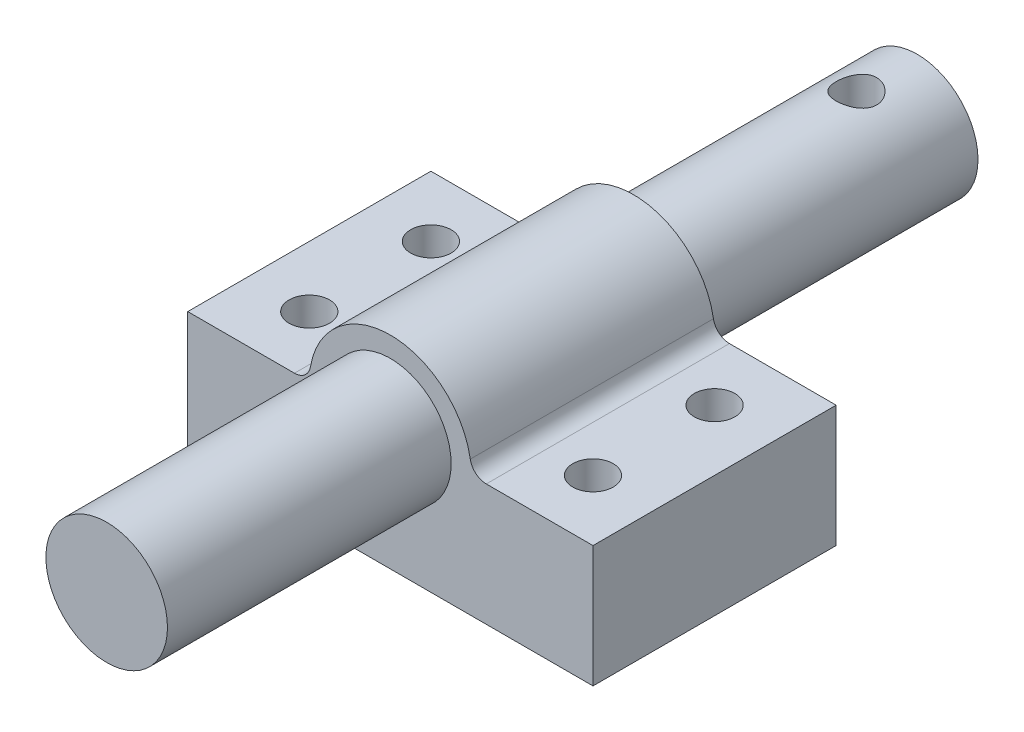
from build123d import *

# Parameters (mm, degrees)
BOSS_EXTRUDE1_DEPTH      = 15
BOSS_EXTRUDE1_DEPTH_BACK = 15
SKETCH6_R                = 2.5
CUT_EXTRUDE2_DEPTH       = 25
CUT_EXTRUDE3_DEPTH       = 35
CUT_EXTRUDE3_DEPTH_BACK  = 30
SKETCH8_R                = 2.5


with BuildPart() as part:
    # Sketch1 → Revolve1 (revolve)
    with BuildSketch(Plane(origin=(0, 0, 0), x_dir=(1, 0, 0), z_dir=(0, 1, 0))):
        Polygon((0, 90), (0, 100), (2, 100), (7.5, 100), (7.5, 65), (9, 65), (9, 35), (7.5, 35), (7.5, 0), (0, 0), align=None)
    revolve(axis=Axis((0, 0, -90), (0, 0, -1)))

    # Sketch5 → Boss-Extrude1 (add, two sides: drawn at the far end of the back side and taken through both)
    with BuildSketch(Plane.XY.offset(-50).offset(-BOSS_EXTRUDE1_DEPTH_BACK)):
        with BuildLine():
            Line((-25, -10), (-25, -15))
            Line((-25, -15), (25, -15))
            Line((25, -15), (25, -10))
            Line((25, -10), (25, 0))
            Line((25, 0), (20, 0))
            Line((20, 0), (12.5, 0))
            Line((12.5, 0), (11.832159566, 0))
            ThreePointArc((11.832159566, 0), (10.541165117, 0.472474768), (9.860132972, 1.666666667))
            ThreePointArc((9.860132972, 1.666666667), (0, 10), (-9.860132972, 1.666666667))
            ThreePointArc((-9.860132972, 1.666666667), (-10.541165117, 0.472474768), (-11.832159566, 0))
            Line((-11.832159566, 0), (-12.5, 0))
            Line((-12.5, 0), (-20, 0))
            Line((-20, 0), (-25, 0))
            Line((-25, 0), (-25, -10))
        make_face()
    extrude(amount=BOSS_EXTRUDE1_DEPTH + BOSS_EXTRUDE1_DEPTH_BACK)

    # Sketch6 → Cut-Extrude2 (cut)
    with BuildSketch(Plane(origin=(0, 0, 0), x_dir=(1, 0, 0), z_dir=(0, 1, 0))):
        with Locations(Location((-17.5, 57.5, 0), (0, 0, 270))):
            Circle(SKETCH6_R)
        with Locations(Location((17.5, 57.5, 0), (0, 0, 270))):
            Circle(SKETCH6_R)
        with Locations(Location((17.5, 42.5, 0), (0, 0, 270))):
            Circle(SKETCH6_R)
        with Locations(Location((-17.5, 42.5, 0), (0, 0, 270))):
            Circle(SKETCH6_R)
    extrude(amount=-CUT_EXTRUDE2_DEPTH, mode=Mode.SUBTRACT)

    # Sketch8 → Cut-Extrude3 (cut, two sides: drawn at the far end of the back side and taken through both)
    with BuildSketch(Plane(origin=(0, 0, 0), x_dir=(1, 0, 0), z_dir=(0, 1, 0)).offset(-CUT_EXTRUDE3_DEPTH_BACK)):
        with Locations(Location((0, 92.5, 0), (0, 0, 270))):
            Circle(SKETCH8_R)
    extrude(amount=CUT_EXTRUDE3_DEPTH + CUT_EXTRUDE3_DEPTH_BACK, mode=Mode.SUBTRACT)


solid = part.part
